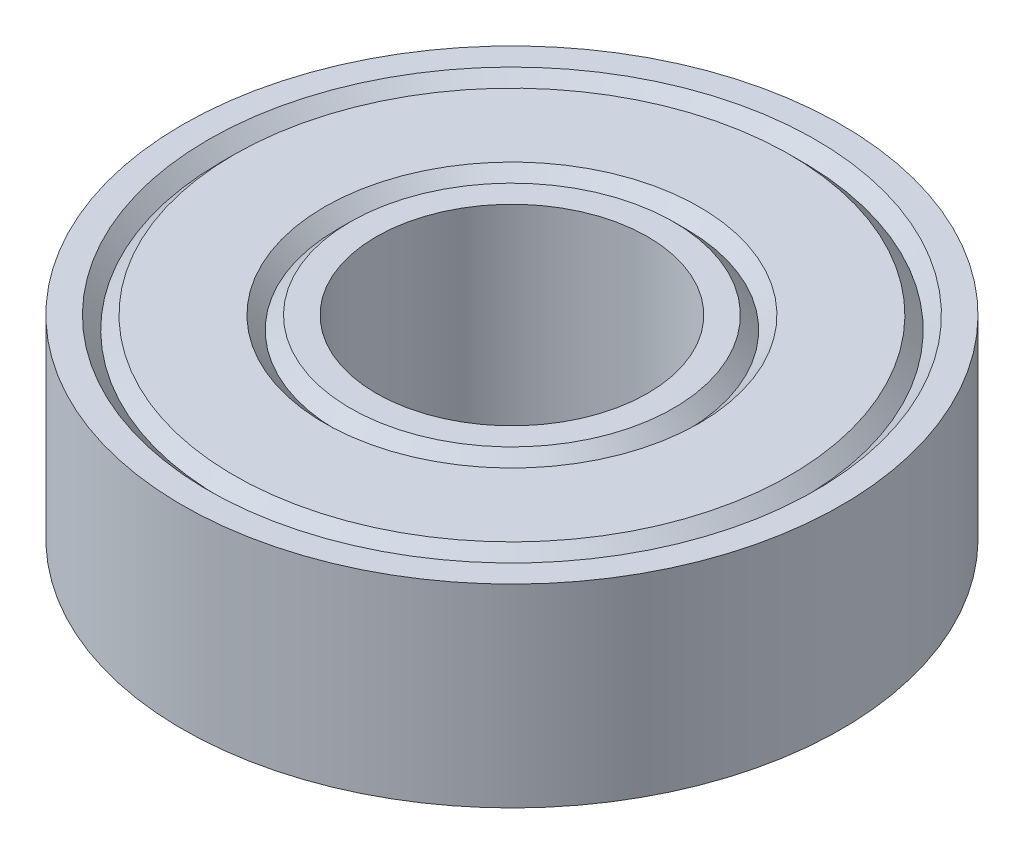
from build123d import *


with BuildPart() as part:
    # Sketch1 → Revolve1 (revolve)
    with BuildSketch(Plane.XY):
        Polygon((-3.5, 2.5), (-4.166666667, 2.5), (-4.5, 2.166666667), (-4.833333333, 2.5), (-7.166666667, 2.5), (-7.5, 2.166666667), (-7.833333333, 2.5), (-8.5, 2.5), (-8.5, -2.5), (-7.833333333, -2.5), (-7.5, -2.166666667), (-7.166666667, -2.5), (-4.833333333, -2.5), (-4.5, -2.166666667), (-4.166666667, -2.5), (-3.5, -2.5), align=None)
    revolve(axis=Axis((0, 2.5, 0), (0, -1, 0)))


solid = part.part
